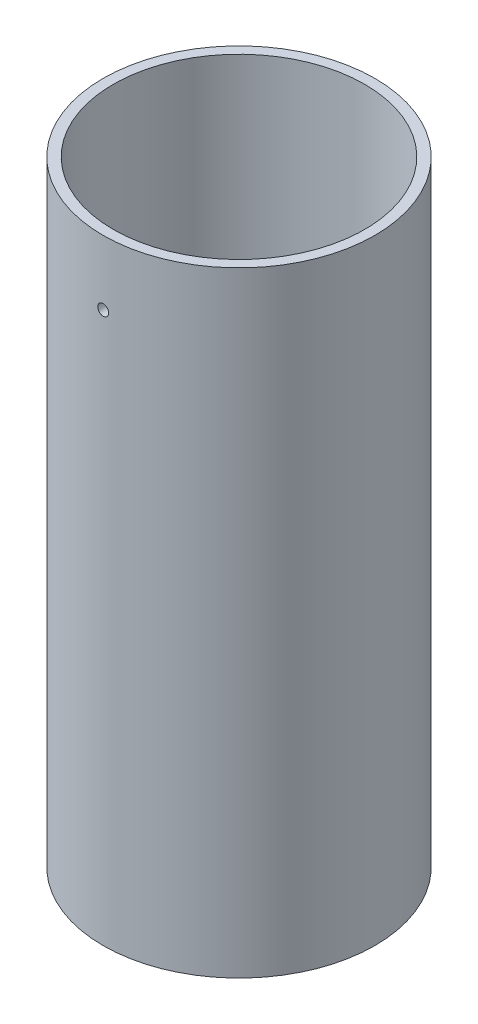
from build123d import *

# Parameters (mm, degrees)
SKETCH_1_R              = 40
SKETCH_1_R_2            = 37
EXTRUDE_1_DEPTH         = 90.5
HOLE_WIZARD_M3_1_REACH  = 187.051
HOLE_WIZARD_M3_1_BORE_R = 1.6


with BuildPart() as part:
    # 草图1 → 凸台-拉伸1 (new, symmetric)
    with BuildSketch(Plane(origin=(0, 0, 0), x_dir=(1, 0, 0), z_dir=(0, 1, 0))):
        with Locations(Location((0, 0, 0), (0, 0, 270))):
            Circle(SKETCH_1_R)
        with Locations(Location((0, 0, 0), (0, 0, 270))):
            Circle(SKETCH_1_R_2, mode=Mode.SUBTRACT)
    extrude(amount=EXTRUDE_1_DEPTH, both=True)

    # M3 间隙孔1 bore (on position points) → M3 间隙孔1 (cut, up to next)
    with BuildSketch(Plane(origin=(0, 71.5, 40), x_dir=(1, 0, 0), z_dir=(0, 0, 1)), mode=Mode.PRIVATE) as hole_wizard_m3_1_sk1:
        Circle(HOLE_WIZARD_M3_1_BORE_R)
    hole_wizard_m3_1_tool1 = extrude(hole_wizard_m3_1_sk1.sketch, amount=-HOLE_WIZARD_M3_1_REACH, mode=Mode.PRIVATE) & part.part
    add(hole_wizard_m3_1_tool1.solids().sort_by_distance((0, 71.5, 40))[0], mode=Mode.SUBTRACT)


solid = part.part
